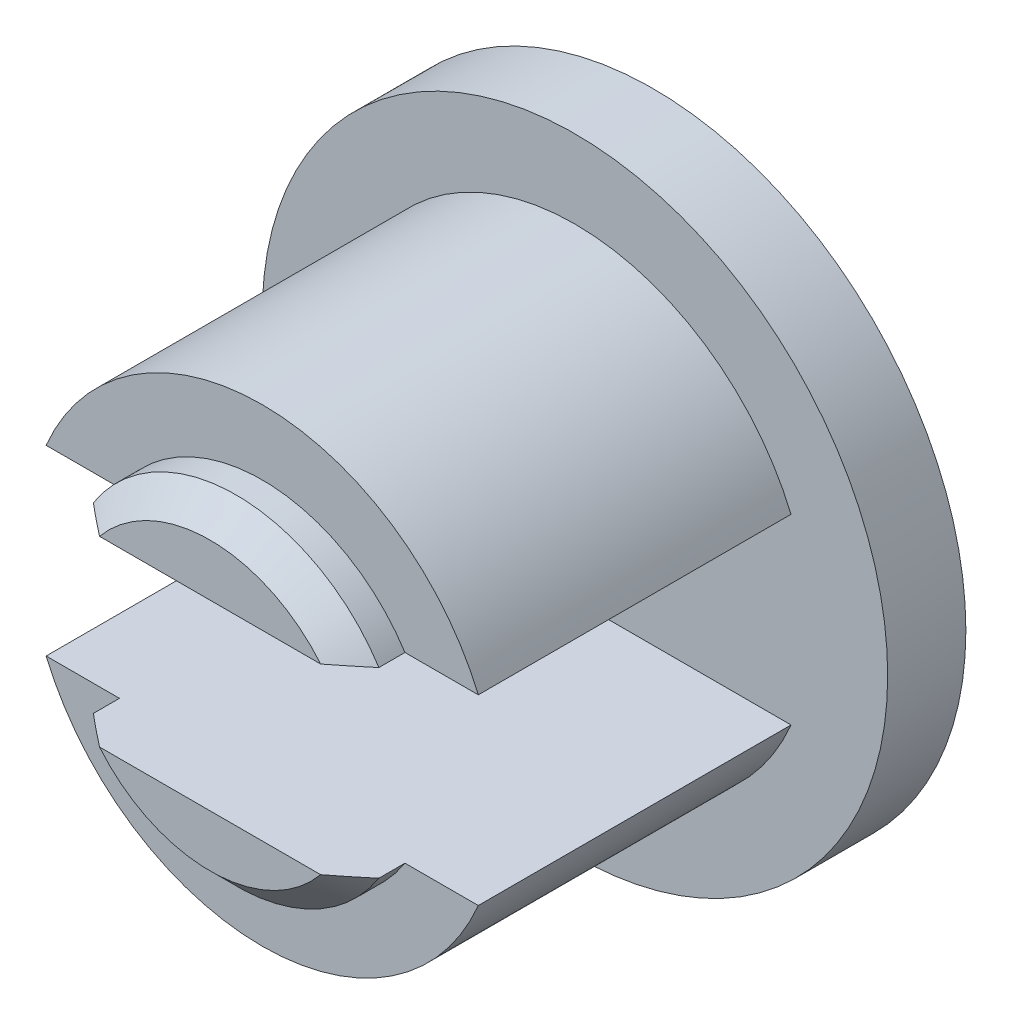
from build123d import *

# Parameters (mm, degrees)
SKETCH_1_R          = 2.5
EXTRUDE_1_DEPTH     = 1.5
SKETCH_3_R          = 6
EXTRUDE_2_DEPTH     = 1.5
SKETCH_4_R          = 4.5
EXTRUDE_3_DEPTH     = 6
SKETCH_5_R          = 3.25
EXTRUDE_4_DEPTH     = 1
CHAMFER_1_SIZE      = 0.5
CUT_EXTRUDE_1_REACH = 15.115
SKETCH_6_W          = 35.44
SKETCH_6_H          = 3.5


with BuildPart() as part:
    # 草图1 → 凸台-拉伸1 (new body)
    with BuildSketch(Plane.XY):
        Circle(SKETCH_1_R)
    extrude(amount=EXTRUDE_1_DEPTH)

    # 草图3 → 凸台-拉伸2 (add)
    with BuildSketch(Plane.XY.offset(1.5)):
        Circle(SKETCH_3_R)
    extrude(amount=EXTRUDE_2_DEPTH)

    # 草图4 → 凸台-拉伸3 (add)
    with BuildSketch(Plane.XY.offset(3)):
        Circle(SKETCH_4_R)
    extrude(amount=EXTRUDE_3_DEPTH)

    # 草图5 → 凸台-拉伸4 (add)
    with BuildSketch(Plane.XY.offset(9)):
        Circle(SKETCH_5_R)
    extrude(amount=EXTRUDE_4_DEPTH)

    # 倒角1
    chamfer_1_edges = [part.edges().sort_by_distance(p)[0] for p in [
        (-3.25, 0, 10),
        (-2.5, 0, 0),
    ]]
    chamfer(chamfer_1_edges, length=CHAMFER_1_SIZE)

    # 切除-拉伸1: up to this face of the body (flat: up to its plane)
    cut_extrude_1_end = Plane(part.part.faces().sort_by_distance((-5.830294373, 0, 3))[0])
    # 草图6 → 切除-拉伸1 (cut, up to the picked face)
    with BuildSketch(Plane.XY.offset(10), mode=Mode.PRIVATE) as cut_extrude_1_sk1:
        Rectangle(SKETCH_6_W, SKETCH_6_H)
    cut_extrude_1_tool1 = split(extrude(cut_extrude_1_sk1.sketch, amount=-CUT_EXTRUDE_1_REACH, mode=Mode.PRIVATE), bisect_by=cut_extrude_1_end, keep=Keep.BOTH, mode=Mode.PRIVATE)
    add(cut_extrude_1_tool1.solids().sort_by(Axis((0, 0, 10), (0, 0, -1)))[0], mode=Mode.SUBTRACT)


solid = part.part
